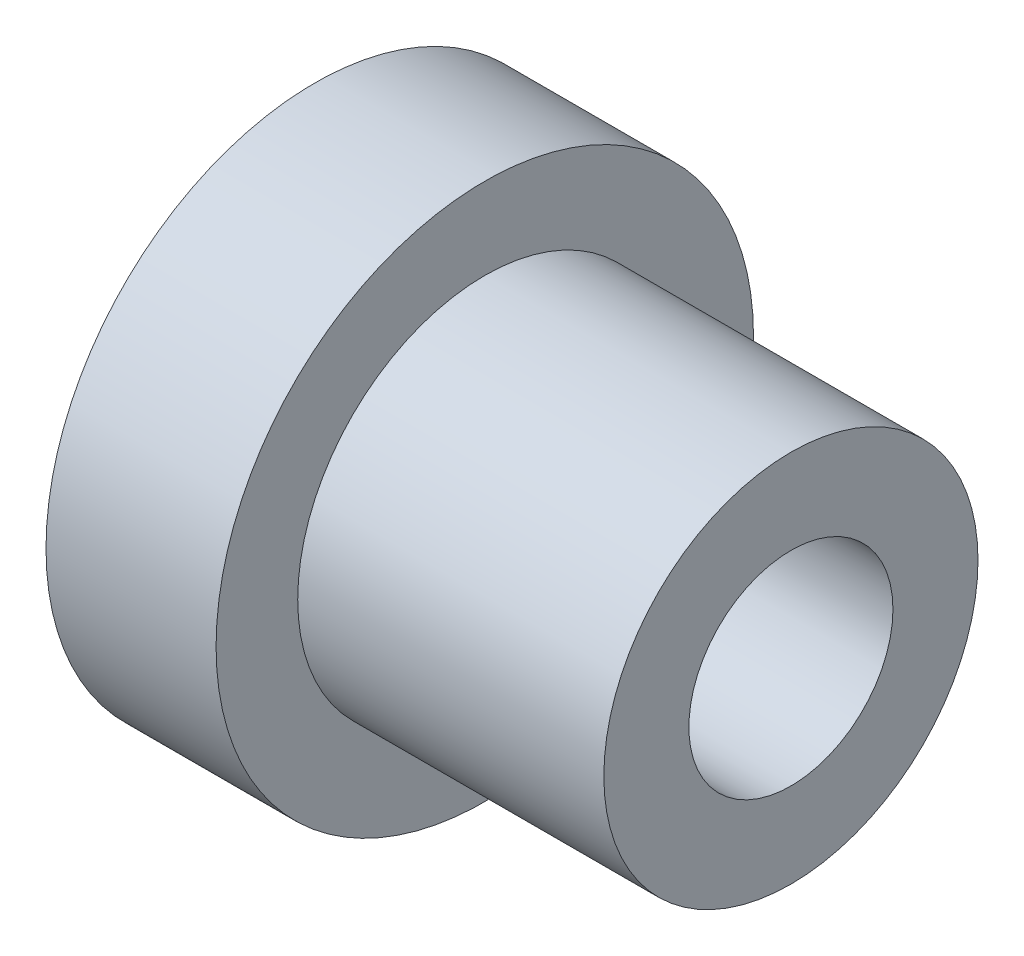
from build123d import *


with BuildPart() as part:
    # Sketch1 → Revolve1 (revolve)
    with BuildSketch(Plane.XY, mode=Mode.PRIVATE) as revolve1_sk:
        Polygon((-2.85, 5.6), (-2.85, 8), (-7.85, 8), (-7.85, 6), (-5.35, 6), (-5.35, 3.1), (6.15, 3.1), (6.15, 5.6), align=None)
    revolve(revolve1_sk.sketch.rotate(Axis((-7.85, 0.1, 0), (1, 0, 0)), 270), axis=Axis((-7.85, 0.1, 0), (1, 0, 0)))


solid = part.part
